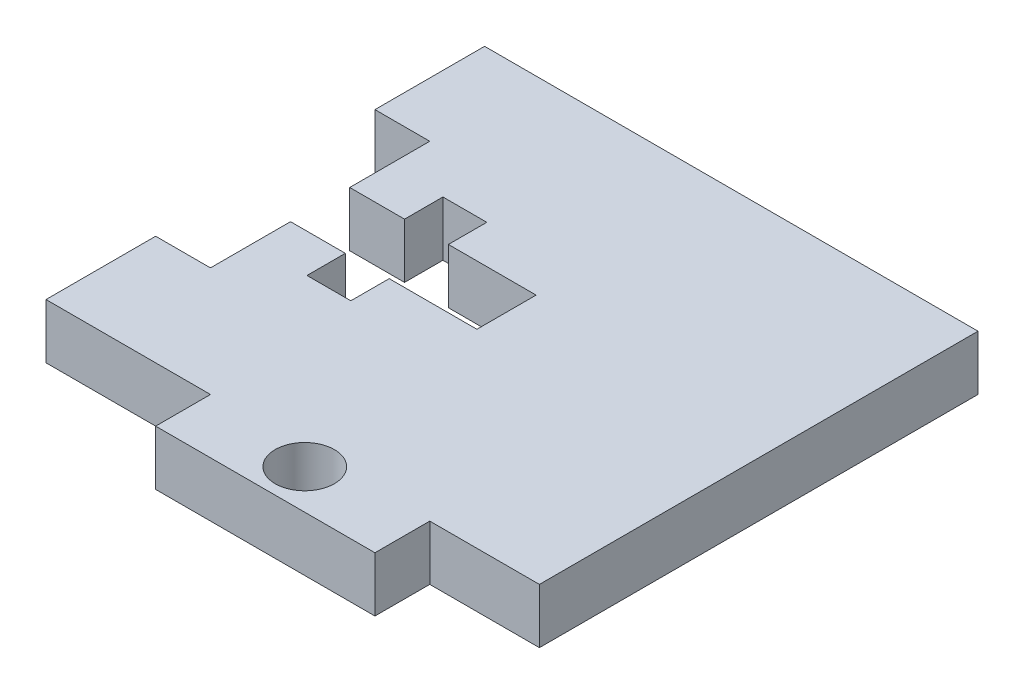
from build123d import *

# Parameters (mm, degrees)
SKETCH1_R           = 1.7145
BOSS_EXTRUDE1_DEPTH = 3.175


with BuildPart() as part:
    # Sketch1 → Boss-Extrude1 (new body)
    with BuildSketch(Plane(origin=(0, 0, 0), x_dir=(1, 0, 0), z_dir=(0, 1, 0))):
        Polygon((0, 19.05), (3.175, 19.05), (3.175, 14.4145), (6.35, 14.4145), (6.35, 16.637), (8.89, 16.637), (8.89, 14.4145), (13.97, 14.4145), (13.97, 10.9855), (8.89, 10.9855), (8.89, 8.763), (6.35, 8.763), (6.35, 10.9855), (3.175, 10.9855), (3.175, 6.35), (0, 6.35), (0, 0), (9.525, 0), (9.525, -3.175), (22.225, -3.175), (22.225, 0), (28.575, 0), (28.575, 25.4), (0, 25.4), align=None)
        with Locations(Location((15.875, -0.889, 0), (0, 0, 270))):
            Circle(SKETCH1_R, mode=Mode.SUBTRACT)
    extrude(amount=BOSS_EXTRUDE1_DEPTH)


solid = part.part
